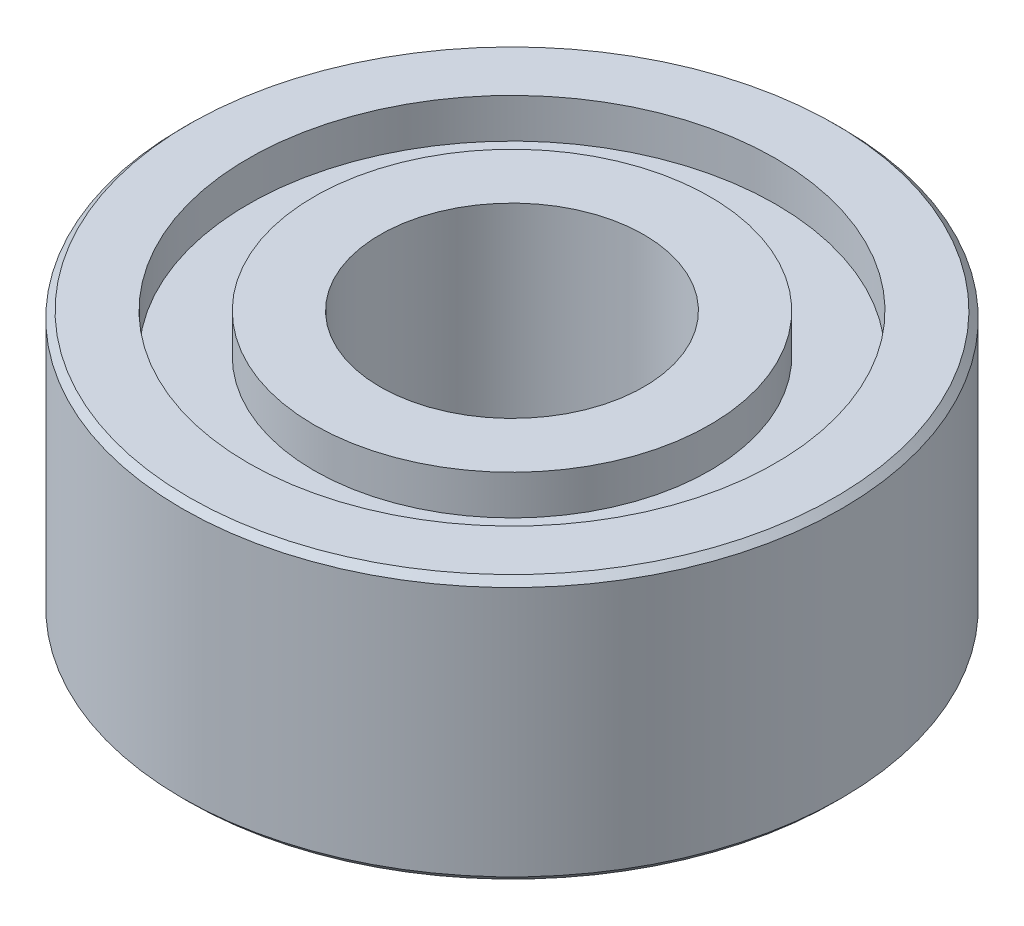
from build123d import *

# Parameters (mm, degrees)
BOSS_EXTRUDE1_DEPTH      = 2
BOSS_EXTRUDE1_DEPTH_BACK = 2
SKETCH1_R                = 5
SKETCH1_R_2              = 2
SKETCH2_R                = 4
SKETCH2_R_2              = 3
CUT_EXTRUDE1_DEPTH       = 0.6
CHAMFER1_SIZE            = 0.1


with BuildPart() as part:
    # Sketch1 → Boss-Extrude1 (new, two sides: drawn at the far end of the back side and taken through both)
    with BuildSketch(Plane(origin=(0, 0, 0), x_dir=(1, 0, 0), z_dir=(0, 1, 0)).offset(-BOSS_EXTRUDE1_DEPTH_BACK)):
        Circle(SKETCH1_R)
        Circle(SKETCH1_R_2, mode=Mode.SUBTRACT)
    extrude(amount=BOSS_EXTRUDE1_DEPTH + BOSS_EXTRUDE1_DEPTH_BACK)

    # Sketch2 → Cut-Extrude1 (cut)
    with BuildSketch(Plane(origin=(0, 2, 0), x_dir=(1, 0, 0), z_dir=(0, 1, 0))):
        Circle(SKETCH2_R)
        Circle(SKETCH2_R_2, mode=Mode.SUBTRACT)
    cut_extrude1 = extrude(amount=-CUT_EXTRUDE1_DEPTH, mode=Mode.SUBTRACT)

    # Mirror2: Cut-Extrude1 across plane
    add(cut_extrude1.mirror(Plane.ZX), mode=Mode.SUBTRACT)

    # Chamfer1
    chamfer1_edges = [part.edges().sort_by_distance(p)[0] for p in [
        (-5, -2, 0),
        (-5, 2, 0),
    ]]
    chamfer(chamfer1_edges, length=CHAMFER1_SIZE)


solid = part.part
